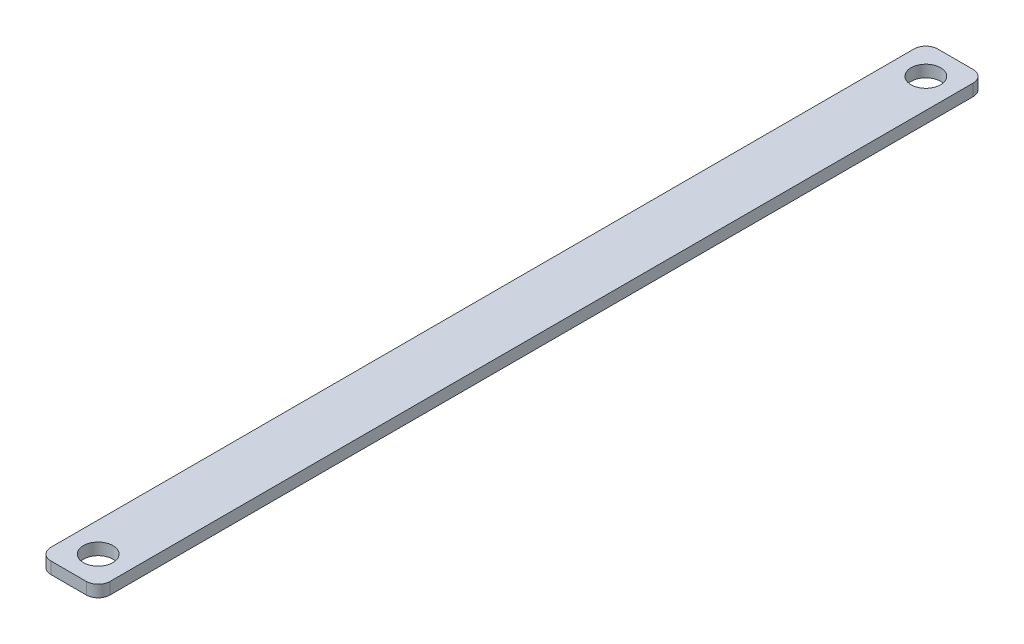
from build123d import *

# Parameters (mm, degrees)
SKETCH1_R           = 12.5
BOSS_EXTRUDE1_DEPTH = 10


with BuildPart() as part:
    # Sketch1 → Boss-Extrude1 (new body)
    with BuildSketch(Plane(origin=(0, 0, 0), x_dir=(1, 0, 0), z_dir=(0, 1, 0))):
        with BuildLine():
            Line((10, 0), (40, 0))
            ThreePointArc((40, 0), (47.071067812, 2.928932188), (50, 10))
            Line((50, 10), (50, 740))
            ThreePointArc((50, 740), (47.071067812, 747.071067812), (40, 750))
            Line((40, 750), (10, 750))
            ThreePointArc((10, 750), (2.928932188, 747.071067812), (0, 740))
            Line((0, 740), (0, 10))
            ThreePointArc((0, 10), (2.928932188, 2.928932188), (10, 0))
        make_face()
        with Locations(Location((25, 25, 0), (0, 0, 270))):
            Circle(SKETCH1_R, mode=Mode.SUBTRACT)
        with Locations(Location((25, 725, 0), (0, 0, 270))):
            Circle(SKETCH1_R, mode=Mode.SUBTRACT)
    extrude(amount=BOSS_EXTRUDE1_DEPTH)


solid = part.part
